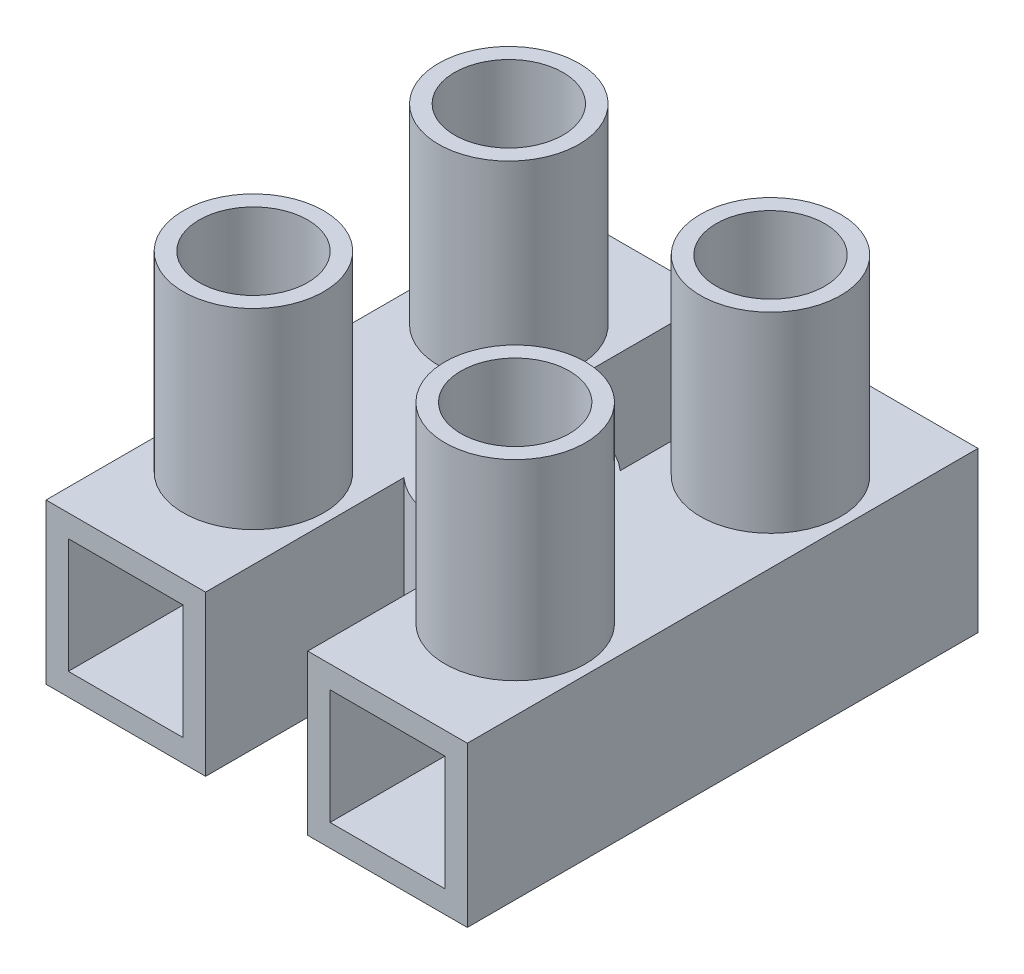
from build123d import *

# Parameters (mm, degrees)
BOSS_EXTRUDE1_DEPTH = 6.35
SKETCH2_R           = 2.286
CUT_EXTRUDE1_DEPTH  = 15.622107372
SKETCH3_W           = 4.572
SKETCH3_H           = 4.572
CUT_EXTRUDE2_DEPTH  = 7.62
SKETCH4_W           = 4.572
SKETCH4_H           = 4.572
CUT_EXTRUDE3_DEPTH  = 7.62
SKETCH5_R           = 2.794
SKETCH5_R_2         = 2.159
BOSS_EXTRUDE2_DEPTH = 7.62


with BuildPart() as part:
    # Sketch1 → Boss-Extrude1 (new body)
    with BuildSketch(Plane(origin=(0, 0, 0), x_dir=(1, 0, 0), z_dir=(0, 1, 0))):
        with BuildLine():
            Line((-2.032, -2.271845065), (-2.032, -10.16))
            Line((-2.032, -10.16), (-8.382, -10.16))
            Line((-8.382, -10.16), (-8.382, 10.16))
            Line((-8.382, 10.16), (-2.032, 10.16))
            Line((-2.032, 10.16), (-2.032, 2.271845065))
            ThreePointArc((-2.032, 2.271845065), (0, 3.048), (2.032, 2.271845065))
            Line((2.032, 2.271845065), (2.032, 10.16))
            Line((2.032, 10.16), (8.382, 10.16))
            Line((8.382, 10.16), (8.382, -10.16))
            Line((8.382, -10.16), (2.032, -10.16))
            Line((2.032, -10.16), (2.032, -2.271845065))
            ThreePointArc((2.032, -2.271845065), (0, -3.048), (-2.032, -2.271845065))
        make_face()
    extrude(amount=-BOSS_EXTRUDE1_DEPTH)

    # Sketch2 → Cut-Extrude1 (cut, through all)
    with BuildSketch(Plane(origin=(0, 0, 0), x_dir=(1, 0, 0), z_dir=(0, 1, 0))):
        with Locations(Location((0, 0, 0), (0, 0, 270))):
            Circle(SKETCH2_R)
    extrude(amount=-CUT_EXTRUDE1_DEPTH, mode=Mode.SUBTRACT)

    # Sketch3 → Cut-Extrude2 (cut)
    with BuildSketch(Plane.XY.offset(10.16)):
        with Locations((-5.207, -3.175)):
            Rectangle(SKETCH3_W, SKETCH3_H)
        with Locations((5.207, -3.175)):
            Rectangle(SKETCH3_W, SKETCH3_H)
    extrude(amount=-CUT_EXTRUDE2_DEPTH, mode=Mode.SUBTRACT)

    # Sketch4 → Cut-Extrude3 (cut)
    with BuildSketch(Plane(origin=(0, 0, -10.16), x_dir=(-1, 0, 0), z_dir=(0, 0, -1))):
        with Locations((-5.207, -3.175)):
            Rectangle(SKETCH4_W, SKETCH4_H)
        with Locations((5.207, -3.175)):
            Rectangle(SKETCH4_W, SKETCH4_H)
    extrude(amount=-CUT_EXTRUDE3_DEPTH, mode=Mode.SUBTRACT)

    # Sketch5 → Boss-Extrude2 (add)
    # profile 1 of 4: a face of its own
    with BuildSketch(Plane(origin=(0, 0, 0), x_dir=(1, 0, 0), z_dir=(0, 1, 0))):
        with Locations(Location((-5.207, -5.08, 0), (0, 0, 90))):
            Circle(SKETCH5_R)
        with Locations(Location((-5.207, -5.08, 0), (0, 0, 90))):
            Circle(SKETCH5_R_2, mode=Mode.SUBTRACT)
    # profile 2 of 4: a face of its own
    with BuildSketch(Plane(origin=(0, 0, 0), x_dir=(1, 0, 0), z_dir=(0, 1, 0))):
        with Locations(Location((-5.207, 5.08, 0), (0, 0, 90))):
            Circle(SKETCH5_R)
        with Locations(Location((-5.207, 5.08, 0), (0, 0, 90))):
            Circle(SKETCH5_R_2, mode=Mode.SUBTRACT)
    # profile 3 of 4: a face of its own
    with BuildSketch(Plane(origin=(0, 0, 0), x_dir=(1, 0, 0), z_dir=(0, 1, 0))):
        with Locations(Location((5.207, 5.08, 0), (0, 0, 90))):
            Circle(SKETCH5_R)
        with Locations(Location((5.207, 5.08, 0), (0, 0, 90))):
            Circle(SKETCH5_R_2, mode=Mode.SUBTRACT)
    # profile 4 of 4: a face of its own
    with BuildSketch(Plane(origin=(0, 0, 0), x_dir=(1, 0, 0), z_dir=(0, 1, 0))):
        with Locations(Location((5.207, -5.08, 0), (0, 0, 90))):
            Circle(SKETCH5_R)
        with Locations(Location((5.207, -5.08, 0), (0, 0, 90))):
            Circle(SKETCH5_R_2, mode=Mode.SUBTRACT)
    extrude(amount=BOSS_EXTRUDE2_DEPTH)


solid = part.part
